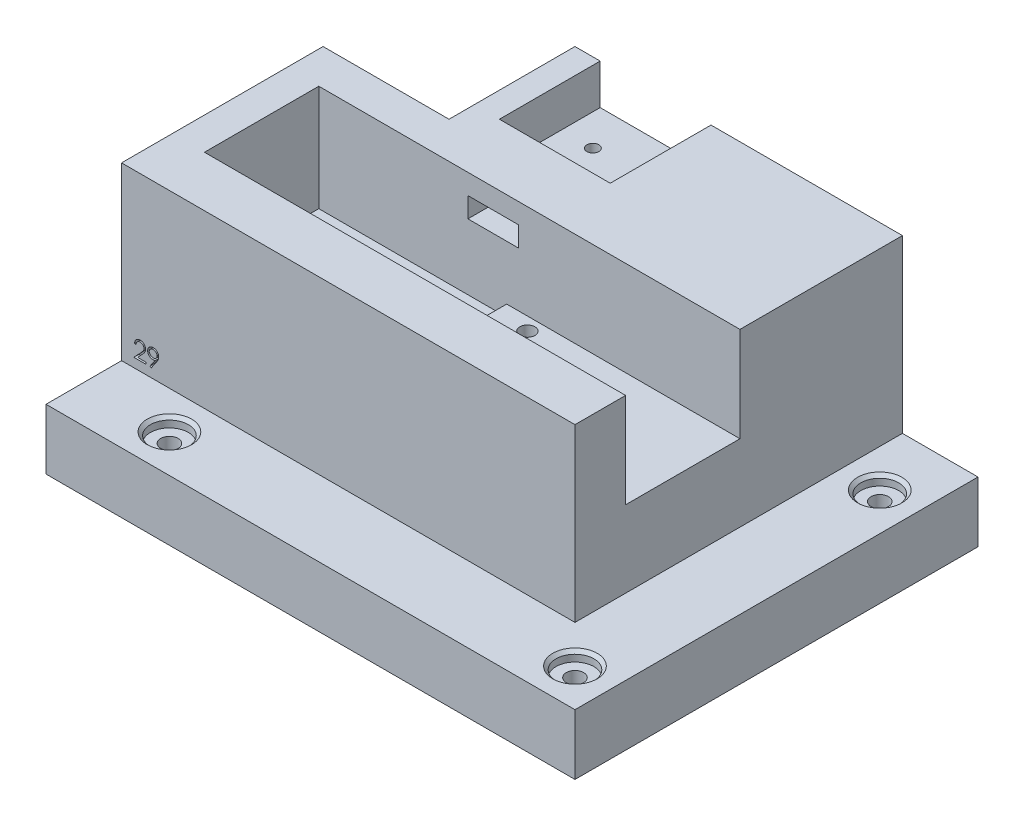
from build123d import *

# Parameters (mm, degrees)
SKETCH1_W                                   = 85
SKETCH1_H                                   = 65
BOSS_EXTRUDE1_DEPTH                         = 46
SKETCH2_W                                   = 20
SKETCH2_H                                   = 25
CUT_EXTRUDE1_DEPTH                          = 46
SKETCH3_R                                   = 3.15
CUT_EXTRUDE2_DEPTH                          = 10
SKETCH4_R                                   = 3.15
CUT_EXTRUDE3_DEPTH                          = 20
SKETCH5_W                                   = 65
SKETCH5_H                                   = 12
BOSS_EXTRUDE2_DEPTH                         = 15
SKETCH6_W                                   = 100
SKETCH6_H                                   = 12
BOSS_EXTRUDE3_DEPTH                         = 15
SKETCH7_W                                   = 82.2
SKETCH7_H                                   = 22.7
CUT_EXTRUDE4_DEPTH                          = 43.2
SKETCH9_R                                   = 3.25
SKETCH9_R_2                                 = 2.35
SKETCH9_R_3                                 = 1.5
CUT_EXTRUDE5_DEPTH                          = 43.2
SKETCH10_W                                  = 37.2
SKETCH10_H                                  = 22.7
CUT_EXTRUDE6_DEPTH                          = 2.25
SKETCH11_W                                  = 4.8
SKETCH11_H                                  = 7
CUT_EXTRUDE7_DEPTH                          = 2.25
CBORE_FOR_5_BINDING_HEAD_MACHINE_SC_2_COUNT = 2
CBORE_FOR_5_BINDING_HEAD_MACHINE_SC_2_PITCH = 60.5
CBORE_FOR_5_BINDING_HEAD_MACHINE_SC_3_COUNT = 2
CBORE_FOR_5_BINDING_HEAD_MACHINE_SC_3_PITCH = 100.700049652
SKETCH15_R                                  = 3.15
BOSS_EXTRUDE4_DEPTH                         = 10
SKETCH16_W                                  = 22.7
SKETCH16_H                                  = 43.2
CUT_EXTRUDE8_DEPTH                          = 1.5
SKETCH17_W                                  = 22
SKETCH17_H                                  = 8
CUT_EXTRUDE9_DEPTH                          = 20
SKETCH18_R                                  = 1.185
CUT_EXTRUDE10_DEPTH                         = 10
CUT_EXTRUDE11_DEPTH                         = 20
BOSS_EXTRUDE5_DEPTH                         = 5
SKETCH21_W                                  = 83.7
SKETCH21_H                                  = 22.7
CUT_EXTRUDE12_DEPTH                         = 5
SKETCH22_W                                  = 46.4
SKETCH22_H                                  = 22.7
CUT_EXTRUDE13_DEPTH                         = 5
SKETCH23_W                                  = 83.7
SKETCH23_H                                  = 22.7
BOSS_EXTRUDE6_DEPTH                         = 27.2
SKETCH24_R                                  = 3.25
SKETCH24_R_2                                = 2.35
SKETCH24_R_3                                = 1.5
CUT_EXTRUDE14_DEPTH                         = 27
SKETCH25_W                                  = 37.3
SKETCH25_H                                  = 22.7
CUT_EXTRUDE15_DEPTH                         = 2.25
CUT_EXTRUDE16_DEPTH                         = 77.25
SKETCH27_W                                  = 15
SKETCH27_H                                  = 80
CUT_EXTRUDE17_DEPTH                         = 47
CUT_EXTRUDE18_DEPTH                         = 20
CUT_EXTRUDE19_DEPTH                         = 1


with BuildPart() as part:
    # Sketch1 → Boss-Extrude1 (new body)
    with BuildSketch(Plane(origin=(0, 0, 0), x_dir=(1, 0, 0), z_dir=(0, 1, 0))):
        with Locations((42.5, -32.5)):
            Rectangle(SKETCH1_W, SKETCH1_H)
    extrude(amount=BOSS_EXTRUDE1_DEPTH)

    # Sketch2 → Cut-Extrude1 (cut)
    with BuildSketch(Plane(origin=(0, 46, 0), x_dir=(1, 0, 0), z_dir=(0, 1, 0))):
        with Locations((10, -12.5)):
            Rectangle(SKETCH2_W, SKETCH2_H)
    extrude(amount=-CUT_EXTRUDE1_DEPTH, mode=Mode.SUBTRACT)

    # Sketch3 → Cut-Extrude2 (cut)
    with BuildSketch(Plane.ZY.offset(-20)):
        with Locations((12.5, 35)):
            Circle(SKETCH3_R)
    extrude(amount=-CUT_EXTRUDE2_DEPTH, mode=Mode.SUBTRACT)

    # Sketch4 → Cut-Extrude3 (cut)
    with BuildSketch(Plane(origin=(0, 0, 0), x_dir=(-1, 0, 0), z_dir=(0, 0, -1))):
        with Locations((-65, 35)):
            Circle(SKETCH4_R)
    extrude(amount=-CUT_EXTRUDE3_DEPTH, mode=Mode.SUBTRACT)

    # Sketch5 → Boss-Extrude2 (add)
    with BuildSketch(Plane(origin=(85, 0, 0), x_dir=(0, 0, -1), z_dir=(1, 0, 0))):
        with Locations((-32.5, 6)):
            Rectangle(SKETCH5_W, SKETCH5_H)
    extrude(amount=BOSS_EXTRUDE2_DEPTH)

    # Sketch6 → Boss-Extrude3 (add)
    with BuildSketch(Plane.XY.offset(65)):
        with Locations((50, 6)):
            Rectangle(SKETCH6_W, SKETCH6_H)
    extrude(amount=BOSS_EXTRUDE3_DEPTH)

    # Sketch7 → Cut-Extrude4 (cut)
    with BuildSketch(Plane.XZ):
        with Locations((42.5, 43.6)):
            Rectangle(SKETCH7_W, SKETCH7_H)
    extrude(amount=-CUT_EXTRUDE4_DEPTH, mode=Mode.SUBTRACT)

    # Sketch9 → Cut-Extrude5 (cut)
    with BuildSketch(Plane.XZ.offset(-43.2)):
        with Locations(Location((65.9, 44.696853648, 0), (0, 0, 270))):
            Circle(SKETCH9_R)
        with Locations(Location((53.6, 44.696853648, 0), (0, 0, 270))):
            Circle(SKETCH9_R_2)
        with Locations(Location((45.3, 53.446853648, 0), (0, 0, 270))):
            Circle(SKETCH9_R_3)
        with Locations(Location((45.3, 35.946853648, 0), (0, 0, 270))):
            Circle(SKETCH9_R_3)
    extrude(amount=-CUT_EXTRUDE5_DEPTH, mode=Mode.SUBTRACT)

    # Sketch10 → Cut-Extrude6 (cut)
    with BuildSketch(Plane.XZ.offset(-43.2)):
        with Locations((20, 43.6)):
            Rectangle(SKETCH10_W, SKETCH10_H)
    extrude(amount=-CUT_EXTRUDE6_DEPTH, mode=Mode.SUBTRACT)

    # Sketch11 → Cut-Extrude7 (cut)
    with BuildSketch(Plane.XZ.offset(-45.45)):
        with Locations((31.93, 43.6)):
            Rectangle(SKETCH11_W, SKETCH11_H)
    extrude(amount=-CUT_EXTRUDE7_DEPTH, mode=Mode.SUBTRACT)

    # Sketch14 → CBORE for #5 Binding Head Machine Screw1 (revolve, cut)
    with BuildSketch(Plane(origin=(92.5, 12, 12), x_dir=(0, 0, 1), z_dir=(1, 0, 0))):
        Polygon((0, 0), (0, 12), (1.7272, 12), (1.7272, 1.9812), (3.77063, 1.9812), (3.77063, 0.635), (4.40563, 0), align=None)
    cbore_for_5_binding_head_machine_screw1 = revolve(axis=Axis((92.5, 18.35, 12), (0, -1, 0)), mode=Mode.SUBTRACT)

    # CBORE for _5 Binding Head Machine Sc 2: CBORE for #5 Binding Head Machine Screw1 ×2
    with Locations(*[(0, 0, i * CBORE_FOR_5_BINDING_HEAD_MACHINE_SC_2_PITCH) for i in range(1, CBORE_FOR_5_BINDING_HEAD_MACHINE_SC_2_COUNT)]):
        add(cbore_for_5_binding_head_machine_screw1, mode=Mode.SUBTRACT)

    # CBORE for _5 Binding Head Machine Sc 3: CBORE for #5 Binding Head Machine Screw1 ×2
    with Locations(*[Vector(-0.7994037766401921, 0, 0.6007941426923183) * (i * CBORE_FOR_5_BINDING_HEAD_MACHINE_SC_3_PITCH) for i in range(1, CBORE_FOR_5_BINDING_HEAD_MACHINE_SC_3_COUNT)]):
        add(cbore_for_5_binding_head_machine_screw1, mode=Mode.SUBTRACT)

    # Sketch15 → Boss-Extrude4 (add)
    with BuildSketch(Plane.ZY.offset(-20)):
        with Locations((12.5, 35)):
            Circle(SKETCH15_R)
    extrude(amount=-BOSS_EXTRUDE4_DEPTH)

    # Sketch16 → Cut-Extrude8 (cut)
    with BuildSketch(Plane.ZY.offset(-83.6)):
        with Locations((43.6, 21.6)):
            Rectangle(SKETCH16_W, SKETCH16_H)
    extrude(amount=-CUT_EXTRUDE8_DEPTH, mode=Mode.SUBTRACT)

    # Sketch17 → Cut-Extrude9 (cut)
    with BuildSketch(Plane(origin=(0, 0, 0), x_dir=(-1, 0, 0), z_dir=(0, 0, -1))):
        with Locations((-36, 42)):
            Rectangle(SKETCH17_W, SKETCH17_H)
    extrude(amount=-CUT_EXTRUDE9_DEPTH, mode=Mode.SUBTRACT)

    # Sketch18 → Cut-Extrude10 (cut)
    with BuildSketch(Plane(origin=(0, 38, 0), x_dir=(1, 0, 0), z_dir=(0, 1, 0))):
        with Locations(Location((31.25, -7.7, 0), (0, 0, 270))):
            Circle(SKETCH18_R)
        with Locations(Location((40.75, -7.7, 0), (0, 0, 270))):
            Circle(SKETCH18_R)
    extrude(amount=-CUT_EXTRUDE10_DEPTH, mode=Mode.SUBTRACT)

    # Sketch19 → Cut-Extrude11 (cut)
    with BuildSketch(Plane(origin=(0, 0, 20), x_dir=(-1, 0, 0), z_dir=(0, 0, -1))):
        Polygon((-41, 42), (-36, 42), (-31, 42), (-31, 38), (-41, 38), align=None)
    extrude(amount=-CUT_EXTRUDE11_DEPTH, mode=Mode.SUBTRACT)

    # Sketch20 → Boss-Extrude5 (add)
    with BuildSketch(Plane.ZY):
        Polygon((25, 46), (65, 46), (65, 12), (80, 12), (80, 0), (25, 0), align=None)
    extrude(amount=BOSS_EXTRUDE5_DEPTH)

    # Sketch21 → Cut-Extrude12 (cut)
    with BuildSketch(Plane.XZ.offset(-45.45)):
        with Locations((43.25, 43.6)):
            Rectangle(SKETCH21_W, SKETCH21_H)
    extrude(amount=-CUT_EXTRUDE12_DEPTH, mode=Mode.SUBTRACT)

    # Sketch22 → Cut-Extrude13 (cut)
    with BuildSketch(Plane(origin=(0, 45.45, 0), x_dir=(1, 0, 0), z_dir=(0, 1, 0))):
        with Locations((61.8, -43.6)):
            Rectangle(SKETCH22_W, SKETCH22_H)
    extrude(amount=-CUT_EXTRUDE13_DEPTH, mode=Mode.SUBTRACT)

    # Sketch23 → Boss-Extrude6 (add)
    with BuildSketch(Plane.XZ):
        with Locations((43.25, 43.6)):
            Rectangle(SKETCH23_W, SKETCH23_H)
    extrude(amount=-BOSS_EXTRUDE6_DEPTH)

    # Sketch24 → Cut-Extrude14 (cut)
    with BuildSketch(Plane(origin=(0, 27.2, 0), x_dir=(1, 0, 0), z_dir=(0, 1, 0))):
        with Locations(Location((66, -43.6, 0), (0, 0, 270))):
            Circle(SKETCH24_R)
        with Locations(Location((53.7, -43.6, 0), (0, 0, 270))):
            Circle(SKETCH24_R_2)
        with Locations(Location((45.4, -34.85, 0), (0, 0, 270))):
            Circle(SKETCH24_R_3)
        with Locations(Location((45.4, -52.35, 0), (0, 0, 270))):
            Circle(SKETCH24_R_3)
    extrude(amount=-CUT_EXTRUDE14_DEPTH, mode=Mode.SUBTRACT)

    # Sketch25 → Cut-Extrude15 (cut)
    with BuildSketch(Plane(origin=(0, 27.2, 0), x_dir=(1, 0, 0), z_dir=(0, 1, 0))):
        with Locations((20.05, -43.6)):
            Rectangle(SKETCH25_W, SKETCH25_H)
    extrude(amount=-CUT_EXTRUDE15_DEPTH, mode=Mode.SUBTRACT)

    # Sketch26 → Cut-Extrude16 (cut)
    with BuildSketch(Plane(origin=(0, 24.95, 0), x_dir=(1, 0, 0), z_dir=(0, 1, 0))):
        Polygon((34.7, -43.6), (34.7, -38.6), (38.7, -38.6), (38.7, -43.6), (38.7, -48.6), (34.7, -48.6), align=None)
    extrude(amount=-CUT_EXTRUDE16_DEPTH, mode=Mode.SUBTRACT)

    # Sketch27 → Cut-Extrude17 (cut)
    with BuildSketch(Plane(origin=(0, 12, 0), x_dir=(1, 0, 0), z_dir=(0, 1, 0))):
        with Locations((92.5, -40)):
            Rectangle(SKETCH27_W, SKETCH27_H)
    extrude(amount=CUT_EXTRUDE17_DEPTH, mode=Mode.SUBTRACT)

    # Sketch28 → Cut-Extrude18 (cut)
    with BuildSketch(Plane(origin=(0, 0, 0), x_dir=(-1, 0, 0), z_dir=(0, 0, -1))):
        Polygon((-65, 38.15), (-61.15, 38.15), (-61.15, 31.85), (-68.15, 31.85), (-68.15, 38.15), align=None)
    extrude(amount=-CUT_EXTRUDE18_DEPTH, mode=Mode.SUBTRACT)

    # Sketch30 → Cut-Extrude19 (cut)
    # profile 1 of 2: a face of its own
    with BuildSketch(Plane.XY.offset(65)):
        with BuildLine():
            Line((-2.112046694, 16.217883175), (-2.426149258, 16.217883175))
            add(Edge.make_bspline(
                [(-2.426149258, 16.217883175), (-2.424102105, 16.259554063), (-2.420081551, 16.341394577), (-2.401253262, 16.460718484), (-2.374312385, 16.574773282), (-2.336220931, 16.682643196), (-2.288914653, 16.785282003), (-2.232184625, 16.882282019), (-2.164990775, 16.973273208), (-2.088784041, 17.057412051), (-2.006015402, 17.134599622), (-1.916709462, 17.201254865), (-1.822864435, 17.257572536), (-1.724765036, 17.304653778), (-1.621304473, 17.339993624), (-1.513421615, 17.366215263), (-1.400642478, 17.381991609), (-1.323802456, 17.383687395), (-1.284722976, 17.384549841)],
                knots=[0, 0, 0, 0, 1.10065271, 2.161652631, 3.183658789, 4.190468796, 5.17591951, 6.163126047, 7.15150782, 8.156236427, 9.156009102, 10.134482811, 11.092018607, 12.041330605, 13.001268258, 13.972401359, 14.968799086, 16, 16, 16, 16], degree=3))
            add(Edge.make_bspline(
                [(-1.284722976, 17.384549841), (-1.246344902, 17.383651385), (-1.170933357, 17.38188595), (-1.060871343, 17.366724921), (-0.956094048, 17.342979329), (-0.856806282, 17.309663913), (-0.763800217, 17.264879486), (-0.676377173, 17.211081947), (-0.593496362, 17.148862116), (-0.518889578, 17.075608302), (-0.450381499, 16.997405918), (-0.391279244, 16.913918014), (-0.340666081, 16.827688728), (-0.298478401, 16.738060527), (-0.267422262, 16.644189498), (-0.243844054, 16.547442296), (-0.23051664, 16.446817485), (-0.228471216, 16.378710929), (-0.227431309, 16.344085098)],
                knots=[0, 0, 0, 0, 1.111607364, 2.184268762, 3.212621178, 4.221274766, 5.211760367, 6.196651075, 7.1921475, 8.207485113, 9.220403448, 10.201281604, 11.166441695, 12.114753415, 13.065576456, 14.026450734, 14.996634279, 16, 16, 16, 16], degree=3))
            add(Edge.make_bspline(
                [(-0.227431309, 16.344085098), (-0.229124572, 16.295337263), (-0.232481384, 16.19869705), (-0.26119576, 16.056682187), (-0.306042271, 15.919088768), (-0.360039628, 15.808351466), (-0.414512072, 15.719117972), (-0.46359958, 15.645649267), (-0.521064391, 15.566543799), (-0.587742889, 15.482066461), (-0.662255761, 15.391555556), (-0.745277924, 15.295065761), (-0.837401406, 15.193593991), (-0.902059907, 15.12428839), (-0.935564322, 15.088375963)],
                knots=[0, 0, 0, 0, 1.184426356, 2.348067706, 3.509069118, 4.696110526, 5.333549288, 6.050745305, 6.844228056, 7.710549037, 8.667450064, 9.695053472, 10.805634456, 12, 12, 12, 12], degree=3))
            Line((-0.935564322, 15.088375963), (-1.811265444, 14.153780611))
            Line((-1.811265444, 14.153780611), (-0.182559515, 14.153780611))
            Line((-0.182559515, 14.153780611), (-0.182559515, 13.794806252))
            Line((-0.182559515, 13.794806252), (-2.560764643, 13.794806252))
            Line((-2.560764643, 13.794806252), (-1.203392848, 15.24332388))
            add(Edge.make_bspline(
                [(-1.203392848, 15.24332388), (-1.170344961, 15.277822186), (-1.106866734, 15.344086373), (-1.017084157, 15.440829333), (-0.936445169, 15.530578874), (-0.864427776, 15.613165422), (-0.802594271, 15.68979699), (-0.747722039, 15.757991694), (-0.703756448, 15.820746144), (-0.656041052, 15.893486758), (-0.609827071, 15.982299075), (-0.570114715, 16.090832764), (-0.545899866, 16.202560017), (-0.542995031, 16.278062054), (-0.541533874, 16.316040226)],
                knots=[0, 0, 0, 0, 1.329631726, 2.553950428, 3.673215718, 4.687767853, 5.603093632, 6.413772471, 7.123043292, 7.734684054, 8.834405432, 9.900288307, 10.943827018, 12, 12, 12, 12], degree=3))
            add(Edge.make_bspline(
                [(-0.541533874, 16.316040226), (-0.542169616, 16.339921624), (-0.543422542, 16.386987275), (-0.554480239, 16.455993034), (-0.571190745, 16.522557848), (-0.595136003, 16.586886467), (-0.626742744, 16.648332119), (-0.665216123, 16.706969599), (-0.709606187, 16.763658564), (-0.760957456, 16.816811862), (-0.817368976, 16.865493068), (-0.876963226, 16.908617153), (-0.94001333, 16.944656264), (-1.006253452, 16.974199761), (-1.075498921, 16.997375142), (-1.147883667, 17.013433722), (-1.223207683, 17.023516206), (-1.274641179, 17.024880378), (-1.300848777, 17.025575482)],
                knots=[0, 0, 0, 0, 0.991446411, 1.95395049, 2.89581595, 3.838931463, 4.798493298, 5.75982156, 6.748411868, 7.785213223, 8.824556874, 9.840280684, 10.836137867, 11.835679398, 12.848801643, 13.863922112, 14.911575587, 16, 16, 16, 16], degree=3))
            add(Edge.make_bspline(
                [(-1.300848777, 17.025575482), (-1.32821961, 17.02486045), (-1.381971406, 17.023456245), (-1.460890439, 17.013633581), (-1.536176217, 16.996687741), (-1.60801812, 16.973511066), (-1.676537706, 16.944052517), (-1.74140175, 16.907360773), (-1.802464639, 16.863577279), (-1.859841162, 16.813936723), (-1.912705141, 16.758669122), (-1.959152017, 16.697059159), (-1.999736031, 16.630231744), (-2.035145265, 16.558367193), (-2.063900955, 16.480813413), (-2.085874105, 16.397845708), (-2.103260952, 16.309824327), (-2.109069473, 16.249039242), (-2.112046694, 16.217883175)],
                knots=[0, 0, 0, 0, 1.031018746, 2.02475058, 2.990194455, 3.934040569, 4.864654155, 5.795059489, 6.735614925, 7.690564532, 8.649604399, 9.611025574, 10.590972636, 11.591080095, 12.624614302, 13.701020113, 14.821632451, 16, 16, 16, 16], degree=3))
        make_face()
    # profile 2 of 2: a face of its own
    with BuildSketch(Plane.XY.offset(65)):
        with BuildLine():
            Line((0.894363562, 13.705062662), (0.64336196, 13.879641989))
            Line((0.64336196, 13.879641989), (1.616519011, 15.302218111))
            add(Edge.make_bspline(
                [(1.616519011, 15.302218111), (1.554428275, 15.294625047), (1.432168155, 15.279673882), (1.309031053, 15.276927228), (1.248430069, 15.275575482)],
                knots=[0, 0, 0, 0, 1.015715272, 2, 2, 2, 2], degree=3))
            add(Edge.make_bspline(
                [(1.248430069, 15.275575482), (1.211688021, 15.276516559), (1.139566594, 15.27836381), (1.033534942, 15.293005618), (0.931649381, 15.315555746), (0.834180025, 15.349204501), (0.74076052, 15.39102271), (0.651594807, 15.442879724), (0.566802916, 15.503886015), (0.487295506, 15.573719007), (0.414983768, 15.650397059), (0.35056047, 15.731552702), (0.297019338, 15.818128673), (0.252542752, 15.908358892), (0.218812299, 16.003540243), (0.194249761, 16.102589643), (0.179127407, 16.206201285), (0.177328311, 16.276726416), (0.176414844, 16.312534617)],
                knots=[0, 0, 0, 0, 1.060718605, 2.082097864, 3.085795603, 4.069760067, 5.054557537, 6.03741023, 7.043284206, 8.066802108, 9.088538119, 10.083643548, 11.053783639, 12.022749082, 12.983451788, 13.964007469, 14.966251758, 16, 16, 16, 16], degree=3))
            add(Edge.make_bspline(
                [(0.176414844, 16.312534617), (0.178149279, 16.36150327), (0.181553623, 16.457618801), (0.20895214, 16.59805257), (0.254012479, 16.730839114), (0.316840856, 16.855629308), (0.395975578, 16.970628047), (0.491084168, 17.074236656), (0.601588132, 17.16498151), (0.724970151, 17.242985588), (0.858323172, 17.305720585), (0.99799183, 17.351959885), (1.14290595, 17.379158633), (1.24107362, 17.382744494), (1.290497376, 17.384549841)],
                knots=[0, 0, 0, 0, 1.022988612, 2.007919123, 2.978103895, 3.94594894, 4.918897164, 5.887013414, 6.875921846, 7.89917871, 8.930658928, 9.948724884, 10.967259574, 12, 12, 12, 12], degree=3))
            add(Edge.make_bspline(
                [(1.290497376, 17.384549841), (1.338985796, 17.382719678), (1.434794343, 17.379103449), (1.575683349, 17.35261948), (1.710624366, 17.307982807), (1.838869353, 17.246298243), (1.957608765, 17.168977335), (2.064384577, 17.076842812), (2.156760116, 16.969837284), (2.234583996, 16.850548794), (2.297054037, 16.722381813), (2.34212632, 16.588597891), (2.369871959, 16.450159169), (2.373368286, 16.356364695), (2.375132793, 16.309029008)],
                knots=[0, 0, 0, 0, 1.026385292, 2.028040595, 3.023318987, 4.028184125, 5.03290303, 6.015178782, 7.004435299, 8.016004309, 9.023023918, 10.015172535, 10.998308025, 12, 12, 12, 12], degree=3))
            add(Edge.make_bspline(
                [(2.375132793, 16.309029008), (2.373954384, 16.272285241), (2.371564277, 16.1977597), (2.354827969, 16.084529357), (2.326407784, 15.969078128), (2.294156085, 15.871356532), (2.263023918, 15.790648082), (2.233722786, 15.726896503), (2.201210633, 15.659795239), (2.163291867, 15.590047901), (2.12252957, 15.516765366), (2.076470294, 15.440682651), (2.026164722, 15.361697657), (1.990335002, 15.308450569), (1.971987761, 15.281184457)],
                knots=[0, 0, 0, 0, 1.179839688, 2.393009684, 3.667231171, 4.993948276, 5.694988576, 6.444077775, 7.246288328, 8.089075292, 8.993003841, 9.939041771, 10.944649915, 12, 12, 12, 12], degree=3))
            Line((1.971987761, 15.281184457), (0.894363562, 13.705062662))
        make_face()
        with BuildLine():
            add(Edge.make_bspline(
                [(1.306623178, 15.634549841), (1.334457192, 15.635310225), (1.388640555, 15.636790434), (1.468017854, 15.645799676), (1.542942057, 15.661773662), (1.613613307, 15.684693374), (1.680740209, 15.712350043), (1.743256537, 15.747562029), (1.801214612, 15.789578664), (1.855002539, 15.83678868), (1.902766539, 15.889239263), (1.94530957, 15.94413637), (1.981470137, 16.00172098), (2.010033414, 16.062714242), (2.033517989, 16.12563145), (2.049736002, 16.191485806), (2.058720335, 16.259934206), (2.06025191, 16.306432864), (2.061030229, 16.330062662)],
                knots=[0, 0, 0, 0, 1.163407946, 2.26475976, 3.333800367, 4.359385343, 5.366239384, 6.363380779, 7.350133999, 8.353570782, 9.349036268, 10.310270964, 11.253520213, 12.184142, 13.120487599, 14.056272588, 15.012232024, 16, 16, 16, 16], degree=3))
            add(Edge.make_bspline(
                [(2.061030229, 16.330062662), (2.06036056, 16.353702327), (2.059040895, 16.400287187), (2.048453595, 16.468836927), (2.029828372, 16.534530188), (2.004837887, 16.597726618), (1.971917649, 16.65790699), (1.932414164, 16.715826862), (1.885481714, 16.771118989), (1.831479148, 16.822482973), (1.773244595, 16.869830872), (1.711184094, 16.911616948), (1.645809178, 16.946638144), (1.577518688, 16.975537114), (1.50617034, 16.99808889), (1.431806351, 17.014306255), (1.354050946, 17.023278009), (1.30126966, 17.024799904), (1.274371575, 17.025575482)],
                knots=[0, 0, 0, 0, 0.972161553, 1.915763587, 2.844109794, 3.775983486, 4.705125789, 5.659731448, 6.655561913, 7.682237399, 8.721216875, 9.739758359, 10.754845918, 11.767244016, 12.7857855, 13.828538656, 14.893392813, 16, 16, 16, 16], degree=3))
            add(Edge.make_bspline(
                [(1.274371575, 17.025575482), (1.247707422, 17.024798651), (1.195392573, 17.023274513), (1.118328413, 17.014323308), (1.044467245, 16.997979824), (0.973325625, 16.97554756), (0.905037164, 16.946635989), (0.839665332, 16.911615113), (0.777590315, 16.869840491), (0.719411594, 16.822445718), (0.665313672, 16.771358072), (0.619188143, 16.715584643), (0.579594251, 16.657937119), (0.546719248, 16.597718611), (0.521716731, 16.534532325), (0.503094729, 16.468836348), (0.492506564, 16.400287338), (0.491187017, 16.353702378), (0.490517409, 16.330062662)],
                knots=[0, 0, 0, 0, 1.099389452, 2.15699305, 3.192601482, 4.213358962, 5.227959689, 6.245255729, 7.266013209, 8.307253147, 9.336162325, 10.327954924, 11.284637477, 12.215801273, 13.149702402, 14.080068371, 15.025723358, 16, 16, 16, 16], degree=3))
            add(Edge.make_bspline(
                [(0.490517409, 16.330062662), (0.491123335, 16.306414463), (0.492318332, 16.259775887), (0.503846122, 16.191249494), (0.523124401, 16.1255613), (0.548943792, 16.062072593), (0.582945382, 16.001400735), (0.62466923, 15.943833373), (0.673574776, 15.888717923), (0.729008264, 15.836910711), (0.789676425, 15.789358536), (0.854473171, 15.747828154), (0.922283008, 15.712755709), (0.993344639, 15.684614325), (1.067131438, 15.662002662), (1.14430657, 15.645829116), (1.224614807, 15.63687685), (1.279024789, 15.635332953), (1.306623178, 15.634549841)],
                knots=[0, 0, 0, 0, 0.952633368, 1.87876736, 2.791047057, 3.707742249, 4.635551637, 5.587206343, 6.568248508, 7.601284464, 8.641511608, 9.671105535, 10.699146789, 11.713763218, 12.747829548, 13.806491675, 14.887386225, 16, 16, 16, 16], degree=3))
        make_face(mode=Mode.SUBTRACT)
    extrude(amount=-CUT_EXTRUDE19_DEPTH, mode=Mode.SUBTRACT)


solid = part.part
